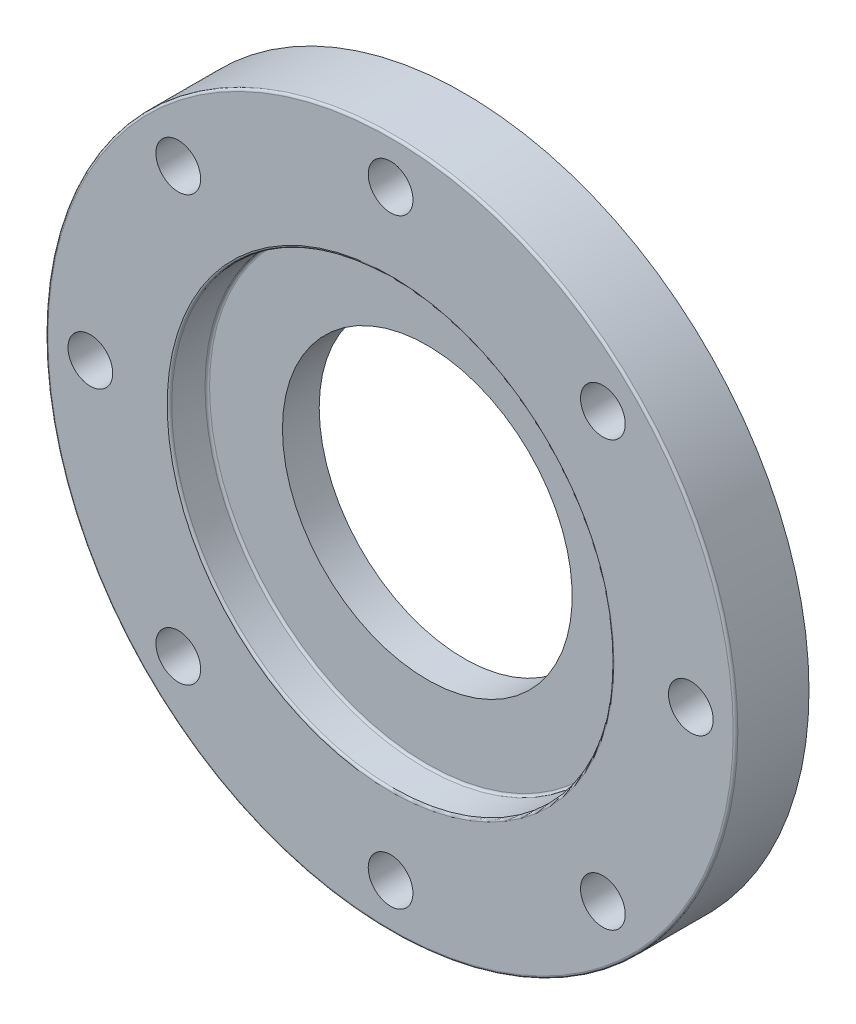
from build123d import *

# Parameters (mm, degrees)
SKETCH1_R          = 171.45
EXTRUDE1_DEPTH     = 36.5125
SKETCH2_R          = 11.1125
EXTRUDE2_DEPTH     = 246.20066814
CIRPATTERN1_COUNT  = 8
FILLET1_R          = 1.154545455
SKETCH5_R          = 72
CUT_EXTRUDE1_DEPTH = 237.236


with BuildPart() as part:
    # Sketch1 → Extrude1 (new body)
    with BuildSketch(Plane.XY):
        Circle(SKETCH1_R)
    extrude(amount=EXTRUDE1_DEPTH)

    # Sketch2 → Extrude2 (cut, through all)
    with BuildSketch(Plane.XY.offset(36.5125)):
        with Locations((0, 149.225)):
            Circle(SKETCH2_R)
    extrude2 = extrude(amount=-EXTRUDE2_DEPTH, mode=Mode.SUBTRACT)

    # CirPattern1: Extrude2 ×8 about axis
    cirpattern1_axis = Axis((0, 0, 0), (0, 0, 1))
    for i in range(1, CIRPATTERN1_COUNT):
        add(extrude2.rotate(cirpattern1_axis, i * 360 / CIRPATTERN1_COUNT), mode=Mode.SUBTRACT)

    # Sketch3 → Cut-Revolve1 (revolve, cut)
    with BuildSketch(Plane(origin=(0, 0, 0), x_dir=(0, 0, -1), z_dir=(1, 0, 0))):
        Polygon((-36.5125, 109.9185), (-18.25625, 109.347), (-18.25625, 0), (-36.5125, 0), align=None)
    revolve(axis=Axis((0, 0, 18.25625), (0, 0, 1)), mode=Mode.SUBTRACT)

    # Fillet1
    fillet1_edges = [part.edges().sort_by_distance(p)[0] for p in [
        (0, -109.347, 18.25625),
        (0, -109.9185, 36.5125),
        (-171.45, 0, 36.5125),
    ]]
    fillet(fillet1_edges, radius=FILLET1_R)

    # Sketch5 → Cut-Extrude1 (cut)
    with BuildSketch(Plane(origin=(0, 0, 0), x_dir=(-1, 0, 0), z_dir=(0, 0, -1))):
        Circle(SKETCH5_R)
    extrude(amount=-CUT_EXTRUDE1_DEPTH, mode=Mode.SUBTRACT)


solid = part.part
